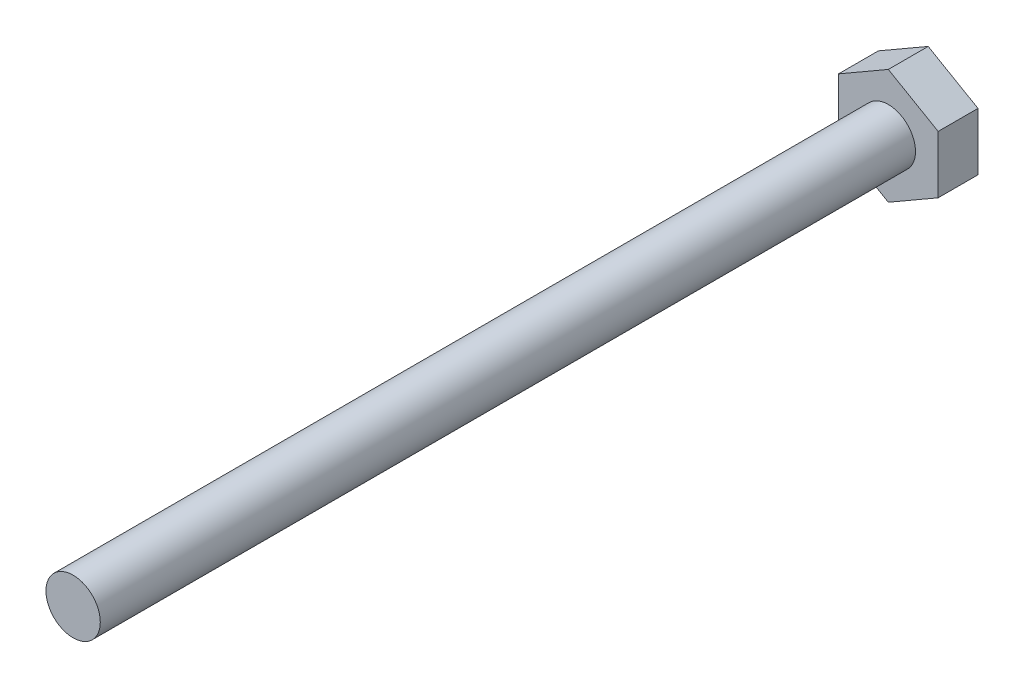
from build123d import *

# Parameters (mm, degrees)
SKETCH_1_R               = 1.5
EXTRUDE_3_DEPTH          = 2.2
SKETCH_1_6_R             = 1.5
EXTRUDE_4_DEPTH          = 47.2
CUT_EXTRUDE_1_DEPTH      = 1
CUT_EXTRUDE_1_DEPTH_BACK = 1


with BuildPart() as part:
    # 草图1 → 凸台-拉伸3 (new body)
    with BuildSketch(Plane.XY):
        Polygon((-2.75, -1.58771324), (0, -3.175426481), (2.75, -1.58771324), (2.75, 1.58771324), (0, 3.175426481), (-2.75, 1.58771324), align=None)
        Circle(SKETCH_1_R, mode=Mode.SUBTRACT)
    extrude(amount=EXTRUDE_3_DEPTH)

    # 草图1<6> → 凸台-拉伸4 (add)
    with BuildSketch(Plane.XY):
        Circle(SKETCH_1_6_R)
    extrude(amount=EXTRUDE_4_DEPTH)

    # 草图1<9> → 切除-拉伸1 (cut, two sides: drawn at the far end of the back side and taken through both)
    with BuildSketch(Plane.XY.offset(-CUT_EXTRUDE_1_DEPTH_BACK)):
        Polygon((0.249002884, 0.249002884), (0.249002884, 0.902887914), (-0.249002884, 0.902887914), (-0.249002884, 0.249002884), (-0.902887914, 0.249002884), (-0.902887914, -0.249002884), (-0.249002884, -0.249002884), (-0.249002884, -0.902887914), (0.249002884, -0.902887914), (0.249002884, -0.249002884), (0.902887914, -0.249002884), (0.902887914, 0.249002884), align=None)
    extrude(amount=CUT_EXTRUDE_1_DEPTH + CUT_EXTRUDE_1_DEPTH_BACK, mode=Mode.SUBTRACT)


solid = part.part
